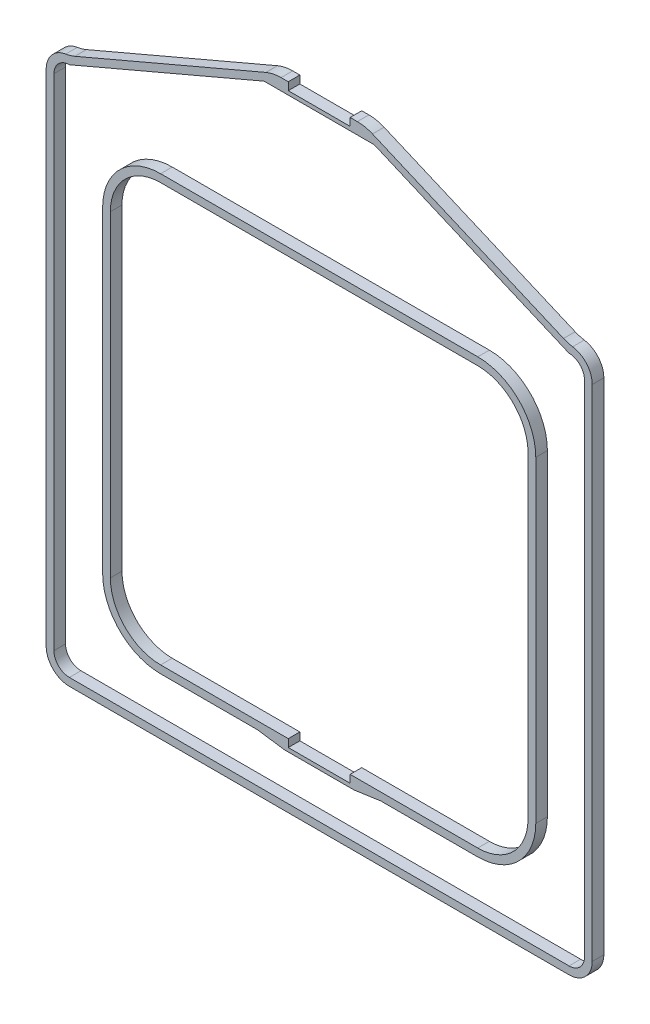
from build123d import *

# Parameters (mm, degrees)
BOSS_EXTRUDE1_DEPTH   = 3
BOSS_EXTRUDE1_2_DEPTH = 3
CUT_EXTRUDE1_DEPTH    = 117.880152293
SKETCH4_W             = 16
SKETCH4_H             = 2
CUT_EXTRUDE2_DEPTH    = 117.880152293


with BuildPart() as part:
    # Sketch2 → Boss-Extrude1 (new body)
    with BuildSketch(Plane.XY):
        with BuildLine():
            Line((-9, -57), (0, -57))
            Line((0, -57), (9, -57))
            Line((9, -57), (15.92820323, -56))
            Line((15.92820323, -56), (41, -56))
            ThreePointArc((41, -56), (51.606601718, -51.606601718), (56, -41))
            Line((56, -41), (56, 41))
            ThreePointArc((56, 41), (51.606601718, 51.606601718), (41, 56))
            Line((41, 56), (-41, 56))
            ThreePointArc((-41, 56), (-51.606601718, 51.606601718), (-56, 41))
            Line((-56, 41), (-56, -41))
            ThreePointArc((-56, -41), (-51.606601718, -51.606601718), (-41, -56))
            Line((-41, -56), (-15.92820323, -56))
            Line((-15.92820323, -56), (-9, -57))
        make_face()
        with BuildLine():
            Line((41, -54), (-41, -54))
            ThreePointArc((-41, -54), (-50.192388155, -50.192388155), (-54, -41))
            Line((-54, -41), (-54, 41))
            ThreePointArc((-54, 41), (-50.192388155, 50.192388155), (-41, 54))
            Line((-41, 54), (41, 54))
            ThreePointArc((41, 54), (50.192388155, 50.192388155), (54, 41))
            Line((54, 41), (54, -41))
            ThreePointArc((54, -41), (50.192388155, -50.192388155), (41, -54))
        make_face(mode=Mode.SUBTRACT)
    extrude(amount=BOSS_EXTRUDE1_DEPTH)

    # Sketch4 → Cut-Extrude2 (cut, through all)
    with BuildSketch(Plane.XY.offset(3)):
        with Locations((0, -55)):
            Rectangle(SKETCH4_W, SKETCH4_H)
    extrude(amount=-CUT_EXTRUDE2_DEPTH, mode=Mode.SUBTRACT)


with BuildPart() as body_2:
    # Sketch2 → Boss-Extrude1 2 (new body)
    with BuildSketch(Plane.XY):
        with BuildLine():
            ThreePointArc((-65.540902989, 70.525765905), (-69.163190657, 68.495804286), (-70.6, 64.6))
            Line((-70.6, 64.6), (-70.6, -64.6))
            ThreePointArc((-70.6, -64.6), (-68.842640687, -68.842640687), (-64.6, -70.6))
            Line((-64.6, -70.6), (64.6, -70.6))
            ThreePointArc((64.6, -70.6), (68.842640687, -68.842640687), (70.6, -64.6))
            Line((70.6, -64.6), (70.6, 64.6))
            ThreePointArc((70.6, 64.6), (69.163190657, 68.495804286), (65.540902989, 70.525765905))
            ThreePointArc((65.540902989, 70.525765905), (64.340790015, 70.792848887), (63.182522555, 71.205184867))
            Line((63.182522555, 71.205184867), (13.781138102, 92.296857547))
            ThreePointArc((13.781138102, 92.296857547), (11.858510235, 92.897157125), (9.854586018, 93.1))
            Line((9.854586018, 93.1), (-9.854586018, 93.1))
            ThreePointArc((-9.854586018, 93.1), (-11.858510235, 92.897157125), (-13.781138102, 92.296857547))
            Line((-13.781138102, 92.296857547), (-63.182522555, 71.205184867))
            ThreePointArc((-63.182522555, 71.205184867), (-64.340790015, 70.792848887), (-65.540902989, 70.525765905))
        make_face()
        with BuildLine():
            Line((-64.6, 68.6), (-14.242222222, 90.1))
            Line((-14.242222222, 90.1), (14.242222222, 90.1))
            Line((14.242222222, 90.1), (64.6, 68.6))
            ThreePointArc((64.6, 68.6), (67.428427125, 67.428427125), (68.6, 64.6))
            Line((68.6, 64.6), (68.6, -64.6))
            ThreePointArc((68.6, -64.6), (67.428427125, -67.428427125), (64.6, -68.6))
            Line((64.6, -68.6), (-64.6, -68.6))
            ThreePointArc((-64.6, -68.6), (-67.428427125, -67.428427125), (-68.6, -64.6))
            Line((-68.6, -64.6), (-68.6, 64.6))
            ThreePointArc((-68.6, 64.6), (-67.428427125, 67.428427125), (-64.6, 68.6))
        make_face(mode=Mode.SUBTRACT)
    extrude(amount=BOSS_EXTRUDE1_2_DEPTH)

    # Sketch3 → Cut-Extrude1 (cut, through all)
    with BuildSketch(Plane.XY.offset(3)):
        Polygon((-6, 93.1), (6, 93.1), (8, 93.1), (8, 91.1), (6, 91.1), (-6, 91.1), (-8, 91.1), (-8, 93.1), align=None)
    extrude(amount=-CUT_EXTRUDE1_DEPTH, mode=Mode.SUBTRACT)


solid = Compound([part.part, body_2.part])
